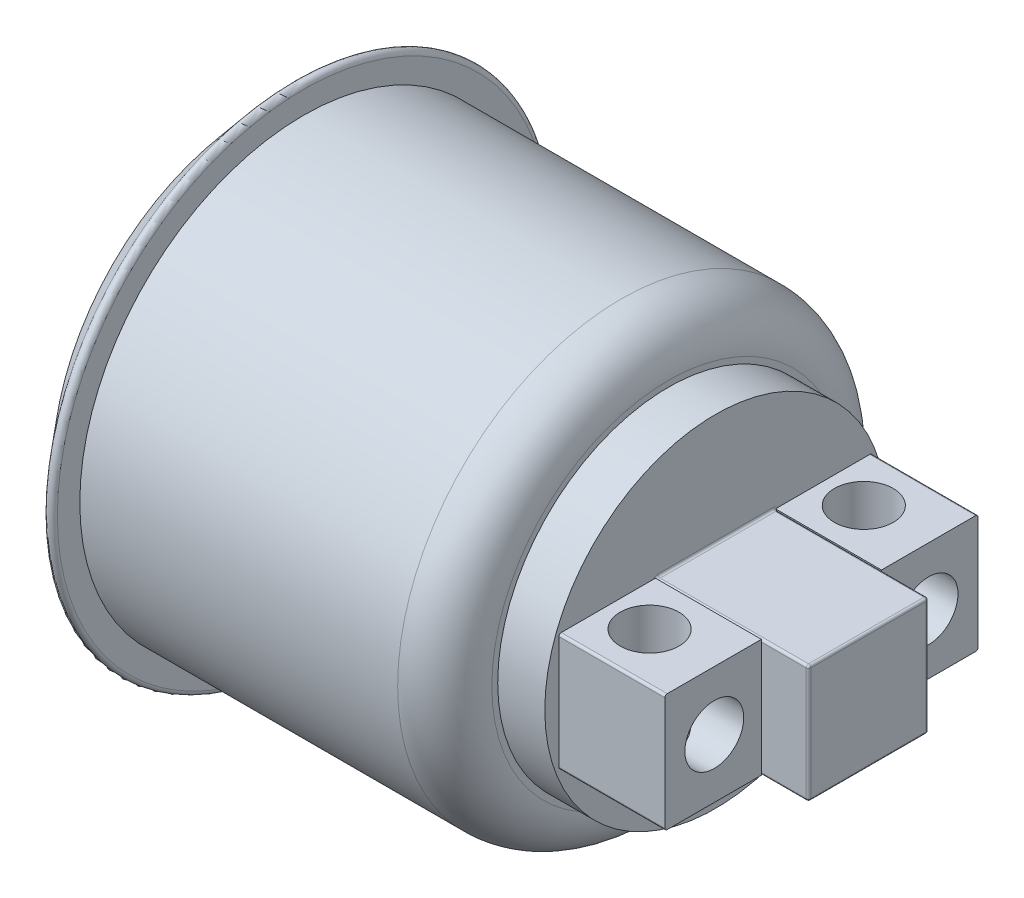
from build123d import *

# Parameters (mm, degrees)
SKETCH_2_R          = 7.51
SKETCH_2_R_2        = 7.5
CUT_EXTRUDE_1_DEPTH = 0.1
FILLET_1_R          = 2
SKETCH_3_R          = 7.25
EXTRUDE_1_DEPTH     = 2
SKETCH_4_W          = 2.55
SKETCH_4_H          = 5
EXTRUDE_2_DEPTH     = 6.5
SKETCH_5_W          = 4.1
SKETCH_5_H          = 5
EXTRUDE_4_DEPTH     = 4.5
EXTRUDE_4_2_DEPTH   = 4.5
FILLET_2_R          = 0.1
FILLET_4_R          = 0.1
FILLET_5_R          = 0.1
SKETCH_6_R          = 1.25
CUT_EXTRUDE_3_DEPTH = 2.7
SKETCH_7_R          = 1.25
CUT_EXTRUDE_4_DEPTH = 32.209934316
FILLET_7_R          = 0.1
FILLET_8_R          = 0.2


with BuildPart() as part:
    # Эскиз1 → Повернуть1 (revolve)
    with BuildSketch(Plane(origin=(0, 0, 0), x_dir=(1, 0, 0), z_dir=(0, 1, 0)), mode=Mode.PRIVATE) as revolve_1_sk:
        Polygon((1.9, 9.5), (1.9, 11), (0, 8.75), (0, 0), (1.9, 0), (17.4, 0), (17.4, 9.5), align=None)
    revolve(revolve_1_sk.sketch.rotate(Axis((0, 0, 0), (1, 0, 0)), 180), axis=Axis((0, 0, 0), (1, 0, 0)))

    # Эскиз2 → Вырез-Вытянуть1 (cut)
    with BuildSketch(Plane.ZY):
        Circle(SKETCH_2_R)
        Circle(SKETCH_2_R_2, mode=Mode.SUBTRACT)
    extrude(amount=-CUT_EXTRUDE_1_DEPTH, mode=Mode.SUBTRACT)

    # Скругление1
    fillet_1_edges = [part.edges().sort_by_distance(p)[0] for p in [
        (17.4, 0, -9.5),
    ]]
    fillet(fillet_1_edges, radius=FILLET_1_R)

    # Эскиз3 → Бобышка-Вытянуть1 (add)
    with BuildSketch(Plane(origin=(17.4, 0, 0), x_dir=(0, 0, -1), z_dir=(1, 0, 0))):
        with Locations(Location((0, 0, 0), (0, 0, 180))):
            Circle(SKETCH_3_R)
    extrude(amount=EXTRUDE_1_DEPTH)

    # Эскиз4 → Бобышка-Вытянуть2 (add)
    with BuildSketch(Plane(origin=(19.4, 0, 0), x_dir=(0, 0, -1), z_dir=(1, 0, 0))):
        with Locations((1.275, 0)):
            Rectangle(SKETCH_4_W, SKETCH_4_H)
        with Locations((-1.275, 0)):
            Rectangle(SKETCH_4_W, SKETCH_4_H)
    extrude(amount=EXTRUDE_2_DEPTH)

    # Скругление7
    fillet_7_edges = [part.edges().sort_by_distance(p)[0] for p in [
        (25.9, 0, -2.55),
        (22.65, -2.5, -2.55),
        (25.9, 2.5, 0),
        (22.65, 2.5, -2.55),
        (19.4, 0, 2.55),
        (22.65, 2.5, 2.55),
        (19.4, -2.5, 0),
        (22.65, -2.5, 2.55),
        (25.9, 0, 2.55),
        (25.9, -2.5, 0),
        (19.4, 0, -2.55),
        (19.4, 2.5, 0),
    ]]
    fillet(fillet_7_edges, radius=FILLET_7_R)

    # Скругление8
    fillet_8_edges = [part.edges().sort_by_distance(p)[0] for p in [
        (1.9, 0, -11),
    ]]
    fillet(fillet_8_edges, radius=FILLET_8_R)


with BuildPart() as body_2:
    # Эскиз5 → Бобышка-Вытянуть4 (new body)
    with BuildSketch(Plane(origin=(19.4, 0, 0), x_dir=(0, 0, -1), z_dir=(1, 0, 0))):
        with Locations((-4.6, 0)):
            Rectangle(SKETCH_5_W, SKETCH_5_H)
    extrude(amount=EXTRUDE_4_DEPTH)

    # Скругление4
    fillet_4_edges = [body_2.edges().sort_by_distance(p)[0] for p in [
        (21.65, -2.5, 6.65),
        (21.65, 2.5, 6.65),
    ]]
    fillet(fillet_4_edges, radius=FILLET_4_R)


with BuildPart() as body_3:
    # Эскиз5 → Extrude 4 2 (new body)
    with BuildSketch(Plane(origin=(19.4, 0, 0), x_dir=(0, 0, -1), z_dir=(1, 0, 0))):
        with Locations((4.6, 0)):
            Rectangle(SKETCH_5_W, SKETCH_5_H)
    extrude(amount=EXTRUDE_4_2_DEPTH)

    # Скругление2
    fillet_2_edges = [body_3.edges().sort_by_distance(p)[0] for p in [
        (21.65, -2.5, -6.65),
    ]]
    fillet(fillet_2_edges, radius=FILLET_2_R)

    # Скругление5
    fillet_5_edges = [body_3.edges().sort_by_distance(p)[0] for p in [
        (21.65, 2.5, -6.65),
    ]]
    fillet(fillet_5_edges, radius=FILLET_5_R)


with BuildPart() as cut_extrude_3_tool:
    # Эскиз6 → Вырез-Вытянуть3 (new body)
    with BuildSketch(Plane(origin=(23.9, 0, 0), x_dir=(0, 0, -1), z_dir=(1, 0, 0))):
        with Locations((-4.55, 0)):
            Circle(SKETCH_6_R)
        with Locations((4.55, 0)):
            Circle(SKETCH_6_R)
    extrude(amount=-CUT_EXTRUDE_3_DEPTH)


with BuildPart() as body_2_1:
    add(body_2.part)

    # Вырез-Вытянуть3: cut by cut_extrude_3_tool
    add(cut_extrude_3_tool.part, mode=Mode.SUBTRACT)


with BuildPart() as body_3_1:
    add(body_3.part)

    # Вырез-Вытянуть3: cut by cut_extrude_3_tool
    add(cut_extrude_3_tool.part, mode=Mode.SUBTRACT)


with BuildPart() as cut_extrude_4_tool:
    # Эскиз7 → Вырез-Вытянуть4 (new, through all)
    with BuildSketch(Plane(origin=(0, 2.5, 0), x_dir=(1, 0, 0), z_dir=(0, 1, 0))):
        with Locations(Location((21.15, 4.55, 0), (0, 0, 270))):
            Circle(SKETCH_7_R)
        with Locations(Location((21.15, -4.55, 0), (0, 0, 270))):
            Circle(SKETCH_7_R)
    extrude(amount=-CUT_EXTRUDE_4_DEPTH)


with BuildPart() as body_2_2:
    add(body_2_1.part)

    # Вырез-Вытянуть4: cut by cut_extrude_4_tool
    add(cut_extrude_4_tool.part, mode=Mode.SUBTRACT)


with BuildPart() as body_3_2:
    add(body_3_1.part)

    # Вырез-Вытянуть4: cut by cut_extrude_4_tool
    add(cut_extrude_4_tool.part, mode=Mode.SUBTRACT)


solid = Compound([part.part, body_2_2.part, body_3_2.part])
